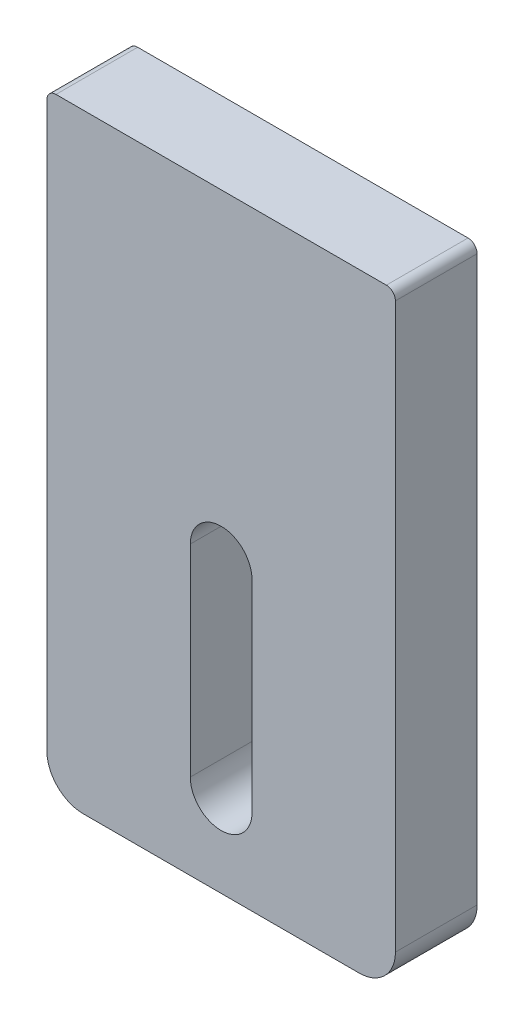
from build123d import *

# Parameters (mm, degrees)
SKETCH1_W           = 19.2
SKETCH1_H           = 33.566975924
BOSS_EXTRUDE1_DEPTH = 5
FILLET1_R           = 2
SKETCH2_W           = 19.2
SKETCH2_H           = 10
CUT_EXTRUDE1_DEPTH  = 0.5
FILLET2_R           = 0.5
CHAMFER1_SIZE       = 0.5


with BuildPart() as part:
    # Sketch1 → Boss-Extrude1 (new body)
    with BuildSketch(Plane.XY):
        with Locations((0, -16.783487962)):
            Rectangle(SKETCH1_W, SKETCH1_H)
        with BuildLine():
            Line((-1.7, -28.866975924), (-1.7, -17.750874329))
            ThreePointArc((-1.7, -17.750874329), (0, -16.050874329), (1.7, -17.750874329))
            Line((1.7, -17.750874329), (1.7, -28.866975924))
            ThreePointArc((1.7, -28.866975924), (0, -30.566975924), (-1.7, -28.866975924))
        make_face(mode=Mode.SUBTRACT)
    extrude(amount=BOSS_EXTRUDE1_DEPTH)

    # Fillet1
    fillet1_edges = [part.edges().sort_by_distance(p)[0] for p in [
        (-9.6, -33.566975924, 2.5),
        (9.6, -33.566975924, 2.5),
    ]]
    fillet(fillet1_edges, radius=FILLET1_R)

    # Sketch2 → Cut-Extrude1 (cut)
    with BuildSketch(Plane.XY):
        with Locations((0, -5)):
            Rectangle(SKETCH2_W, SKETCH2_H)
    extrude(amount=CUT_EXTRUDE1_DEPTH, mode=Mode.SUBTRACT)

    # Fillet2
    fillet2_edges = [part.edges().sort_by_distance(p)[0] for p in [
        (-9.6, 0, 2.75),
        (9.6, 0, 2.75),
    ]]
    fillet(fillet2_edges, radius=FILLET2_R)

    # Chamfer1
    chamfer1_edges = [part.edges().sort_by_distance(p)[0] for p in [
        (-9.6, -20.783487962, 0),
        (-9.014213562, -32.981189486, 0),
        (0, -33.566975924, 0),
        (9.014213562, -32.981189486, 0),
        (9.6, -20.783487962, 0),
    ]]
    chamfer(chamfer1_edges, length=CHAMFER1_SIZE)


solid = part.part
